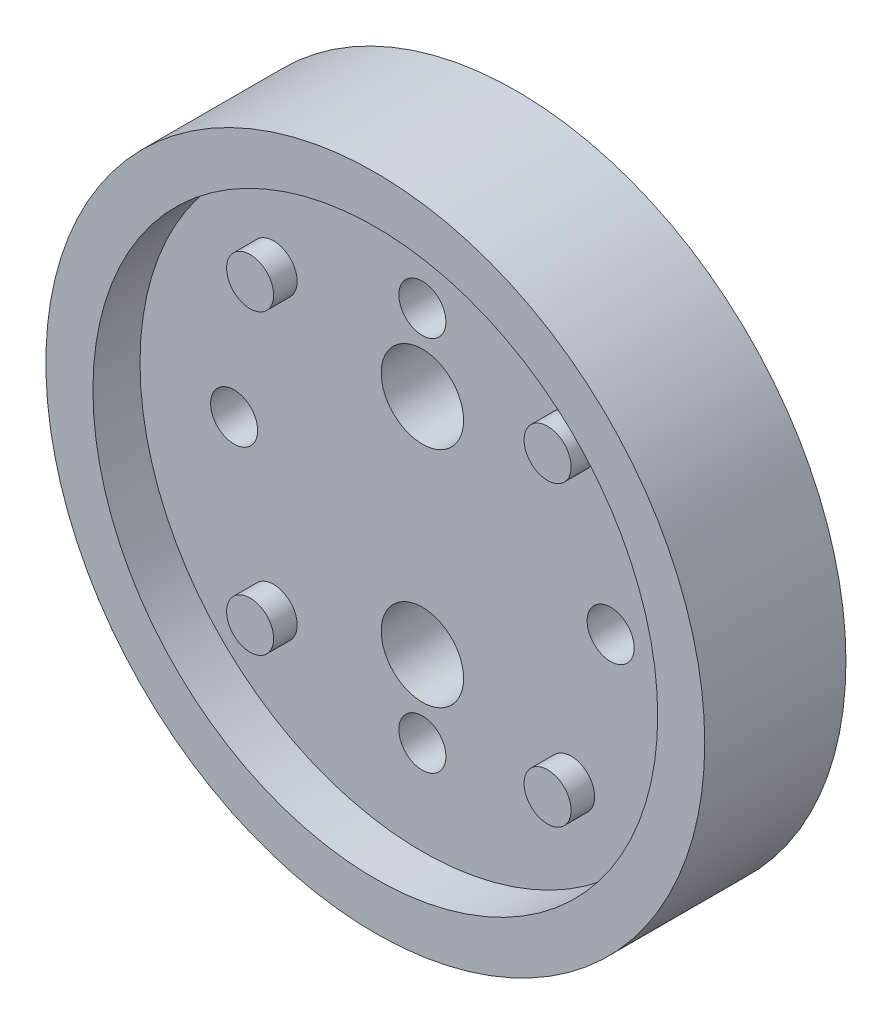
from build123d import *

# Parameters (mm, degrees)
SKETCH1_R           = 14
BOSS_EXTRUDE1_DEPTH = 4
SKETCH2_R           = 14
SKETCH2_R_2         = 12
BOSS_EXTRUDE2_DEPTH = 2
SKETCH3_R           = 1
CUT_EXTRUDE1_DEPTH  = 21.199009877
SKETCH4_R           = 1.75
CUT_EXTRUDE2_DEPTH  = 21.199009877
SKETCH5_R           = 1
BOSS_EXTRUDE3_DEPTH = 1


with BuildPart() as part:
    # Sketch1 → Boss-Extrude1 (new body)
    with BuildSketch(Plane.XY):
        Circle(SKETCH1_R)
    extrude(amount=BOSS_EXTRUDE1_DEPTH)

    # Sketch2 → Boss-Extrude2 (add)
    with BuildSketch(Plane.XY.offset(4)):
        Circle(SKETCH2_R)
        Circle(SKETCH2_R_2, mode=Mode.SUBTRACT)
    extrude(amount=BOSS_EXTRUDE2_DEPTH)

    # Sketch3 → Cut-Extrude1 (cut, through all)
    with BuildSketch(Plane.XY.offset(4)):
        with Locations((0, 8)):
            Circle(SKETCH3_R)
        with Locations((8, 0)):
            Circle(SKETCH3_R)
        with Locations((0, -8)):
            Circle(SKETCH3_R)
        with Locations((-8, 0)):
            Circle(SKETCH3_R)
    extrude(amount=-CUT_EXTRUDE1_DEPTH, mode=Mode.SUBTRACT)

    # Sketch4 → Cut-Extrude2 (cut, through all)
    with BuildSketch(Plane.XY.offset(4)):
        with Locations((0, 4.75)):
            Circle(SKETCH4_R)
        with Locations((0, -4.75)):
            Circle(SKETCH4_R)
    extrude(amount=-CUT_EXTRUDE2_DEPTH, mode=Mode.SUBTRACT)

    # Sketch5 → Boss-Extrude3 (add)
    with BuildSketch(Plane.XY.offset(4)):
        with Locations((-6.320770843, -6.320770843)):
            Circle(SKETCH5_R)
        with Locations((-6.320770843, 6.320770843)):
            Circle(SKETCH5_R)
        with Locations((6.320770843, 6.320770843)):
            Circle(SKETCH5_R)
        with Locations((6.320770843, -6.320770843)):
            Circle(SKETCH5_R)
    extrude(amount=BOSS_EXTRUDE3_DEPTH)


solid = part.part
